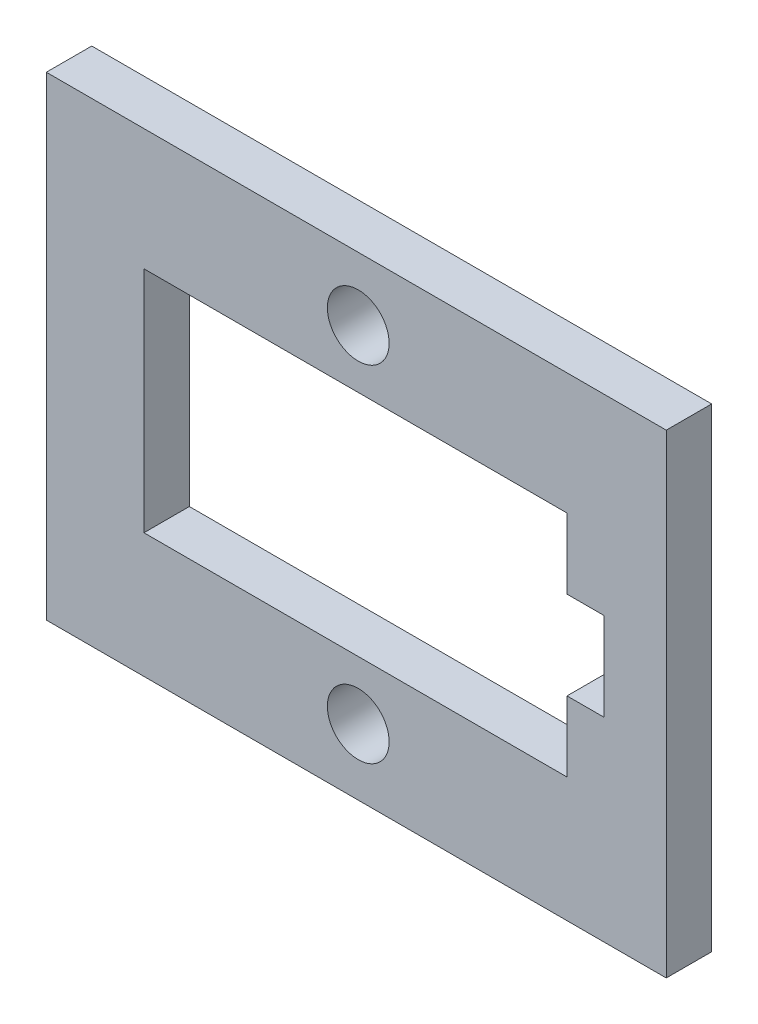
from build123d import *

# Parameters (mm, degrees)
SKETCH1_W           = 34.124427795
SKETCH1_H           = 26.117733668
SKETCH1_R           = 1.70000044
BOSS_EXTRUDE3_DEPTH = 2.5


with BuildPart() as part:
    # Sketch1 → Boss-Extrude3 (new body)
    with BuildSketch(Plane.XY):
        with Locations((17.062213898, 13.058866834)):
            Rectangle(SKETCH1_W, SKETCH1_H)
        with Locations((17.170001507, 3.630000591)):
            Circle(SKETCH1_R, mode=Mode.SUBTRACT)
        with Locations((17.170000399, 22.630012776)):
            Circle(SKETCH1_R, mode=Mode.SUBTRACT)
        Polygon((30.684032724, 15.567255888), (28.662081374, 15.567255888), (28.662081374, 19.434703738), (5.372492357, 19.434703738), (5.372492357, 6.850018518), (28.662081374, 6.850018518), (28.662081374, 10.717466368), (30.684032724, 10.717466368), align=None, mode=Mode.SUBTRACT)
    extrude(amount=BOSS_EXTRUDE3_DEPTH)


solid = part.part
